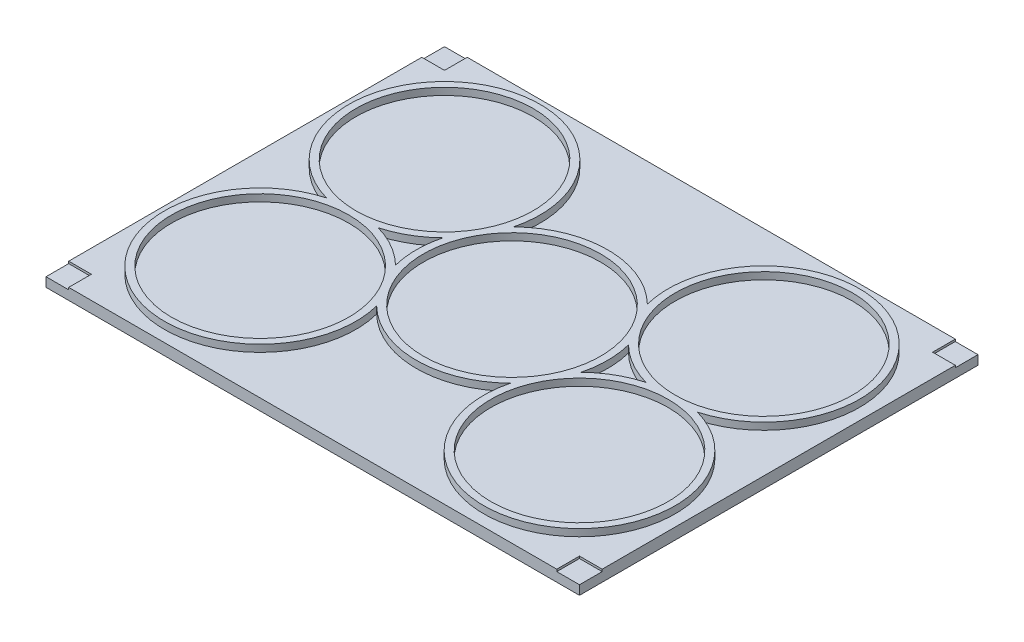
from build123d import *

# Parameters (mm, degrees)
SKETCH1_W           = 75.233320997
SKETCH1_H           = 56.2
BOSS_EXTRUDE1_DEPTH = 1.6
SKETCH2_R           = 13.5
SKETCH2_R_2         = 12.5
BOSS_EXTRUDE2_DEPTH = 1
SKETCH3_W           = 3.2
SKETCH3_H           = 3.2
CUT_EXTRUDE1_DEPTH  = 0.3


with BuildPart() as part:
    # Sketch1 → Boss-Extrude1 (new body)
    with BuildSketch(Plane(origin=(0, 0, 0), x_dir=(1, 0, 0), z_dir=(0, 1, 0))):
        with Locations((-12.172352394, -5.629712982)):
            Rectangle(SKETCH1_W, SKETCH1_H)
    extrude(amount=BOSS_EXTRUDE1_DEPTH)

    # Sketch2 → Boss-Extrude2 (add)
    # profile 1 of 5: a face of its own
    with BuildSketch(Plane(origin=(0, 1.6, 0), x_dir=(1, 0, 0), z_dir=(0, 1, 0))):
        with Locations((10.344308105, 7.370287018)):
            Circle(SKETCH2_R)
        with Locations(Location((10.344308105, 7.370287018, 0), (0, 0, 270))):
            Circle(SKETCH2_R_2, mode=Mode.SUBTRACT)
    # profile 2 of 5: a face of its own
    with BuildSketch(Plane(origin=(0, 1.6, 0), x_dir=(1, 0, 0), z_dir=(0, 1, 0))):
        with Locations((10.344308105, -18.629712982)):
            Circle(SKETCH2_R)
        with Locations(Location((10.344308105, -18.629712982, 0), (0, 0, 270))):
            Circle(SKETCH2_R_2, mode=Mode.SUBTRACT)
    # profile 3 of 5: a face of its own
    with BuildSketch(Plane(origin=(0, 1.6, 0), x_dir=(1, 0, 0), z_dir=(0, 1, 0))):
        with Locations((-12.172352394, -5.629712982)):
            Circle(SKETCH2_R)
        with Locations(Location((-12.172352394, -5.629712982, 0), (0, 0, 270))):
            Circle(SKETCH2_R_2, mode=Mode.SUBTRACT)
    # profile 4 of 5: a face of its own
    with BuildSketch(Plane(origin=(0, 1.6, 0), x_dir=(1, 0, 0), z_dir=(0, 1, 0))):
        with Locations((-34.689012892, 7.370287018)):
            Circle(SKETCH2_R)
        with Locations(Location((-34.689012892, 7.370287018, 0), (0, 0, 270))):
            Circle(SKETCH2_R_2, mode=Mode.SUBTRACT)
    # profile 5 of 5: a face of its own
    with BuildSketch(Plane(origin=(0, 1.6, 0), x_dir=(1, 0, 0), z_dir=(0, 1, 0))):
        with Locations((-34.689012892, -18.629712982)):
            Circle(SKETCH2_R)
        with Locations(Location((-34.689012892, -18.629712982, 0), (0, 0, 270))):
            Circle(SKETCH2_R_2, mode=Mode.SUBTRACT)
    extrude(amount=BOSS_EXTRUDE2_DEPTH)

    # Sketch3 → Cut-Extrude1 (cut)
    with BuildSketch(Plane(origin=(0, 1.6, 0), x_dir=(1, 0, 0), z_dir=(0, 1, 0))):
        with Locations((-48.189012892, -32.129712982)):
            Rectangle(SKETCH3_W, SKETCH3_H)
        with Locations((23.844308105, -32.129712982)):
            Rectangle(SKETCH3_W, SKETCH3_H)
        with Locations((23.844308105, 20.870287018)):
            Rectangle(SKETCH3_W, SKETCH3_H)
        with Locations((-48.189012892, 20.870287018)):
            Rectangle(SKETCH3_W, SKETCH3_H)
    extrude(amount=-CUT_EXTRUDE1_DEPTH, mode=Mode.SUBTRACT)


solid = part.part
